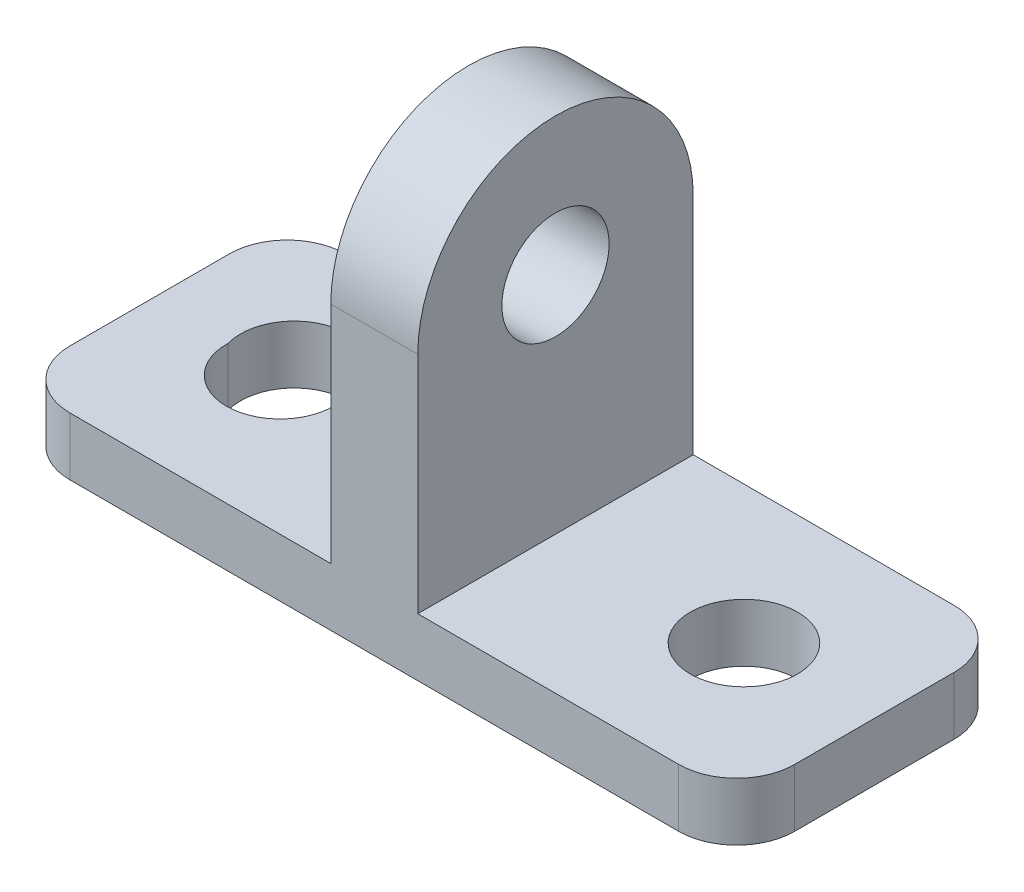
from build123d import *

# Parameters (mm, degrees)
SKETCH1_W           = 25
SKETCH1_H           = 14.5
BOSS_EXTRUDE1_DEPTH = 9.5
CUT_EXTRUDE1_DEPTH  = 28.709429803
SKETCH3_W           = 11
SKETCH3_H           = 12.5
CUT_EXTRUDE2_DEPTH  = 18.293423606
SKETCH4_R           = 1.85
CUT_EXTRUDE3_DEPTH  = 19.406860134
FILLET1_R           = 2
SKETCH5_R           = 1.85
CUT_EXTRUDE4_DEPTH  = 21.06863224
SKETCH11_R          = 1.85
CUT_EXTRUDE10_DEPTH = 104.327776008


with BuildPart() as part:
    # Sketch1 → Boss-Extrude1 (new body)
    with BuildSketch(Plane.XY):
        Rectangle(SKETCH1_W, SKETCH1_H)
    extrude(amount=BOSS_EXTRUDE1_DEPTH)

    # Sketch2 → Cut-Extrude1 (cut, through all)
    with BuildSketch(Plane(origin=(12.5, 0, 0), x_dir=(0, 0, -1), z_dir=(1, 0, 0))):
        with BuildLine():
            Line((-9.5, 2.5), (-9.5, 8.25))
            Line((-9.5, 8.25), (0, 8.25))
            Line((0, 8.25), (0, 2.5))
            ThreePointArc((0, 2.5), (-4.75, 7.25), (-9.5, 2.5))
        make_face()
    extrude(amount=-CUT_EXTRUDE1_DEPTH, mode=Mode.SUBTRACT)

    # Sketch3 → Cut-Extrude2 (cut, through all)
    with BuildSketch(Plane.XY.offset(9.5)):
        with Locations((7, 1)):
            Rectangle(SKETCH3_W, SKETCH3_H)
        with Locations((-7, 1)):
            Rectangle(SKETCH3_W, SKETCH3_H)
    extrude(amount=-CUT_EXTRUDE2_DEPTH, mode=Mode.SUBTRACT)

    # Sketch4 → Cut-Extrude3 (cut, through all)
    with BuildSketch(Plane(origin=(1.5, 0, 0), x_dir=(0, 0, -1), z_dir=(1, 0, 0))):
        with Locations(Location((-4.75, 2.5, 0), (0, 0, 90))):
            Circle(SKETCH4_R)
    extrude(amount=-CUT_EXTRUDE3_DEPTH, mode=Mode.SUBTRACT)

    # Fillet1
    fillet1_edges = [part.edges().sort_by_distance(p)[0] for p in [
        (12.5, -6.25, 9.5),
        (12.5, -6.25, 0),
        (-12.5, -6.25, 9.5),
        (-12.5, -6.25, 0),
    ]]
    fillet(fillet1_edges, radius=FILLET1_R)

    # Sketch5 → Cut-Extrude4 (cut, through all)
    with BuildSketch(Plane(origin=(0, -5.25, 0), x_dir=(1, 0, 0), z_dir=(0, 1, 0))):
        with Locations(Location((-8, -4.75, 0), (0, 0, 180))):
            Circle(SKETCH5_R)
        with Locations(Location((8, -4.75, 0), (0, 0, 180))):
            Circle(SKETCH5_R)
    extrude(amount=-CUT_EXTRUDE4_DEPTH, mode=Mode.SUBTRACT)

    # Sketch11 → Cut-Extrude10 (cut, through all)
    with BuildSketch(Plane(origin=(-55.7, -5.25, -67.11030802), x_dir=(-1, 0, 0), z_dir=(0, 1, 0))):
        with Locations((-47.633605072, 71.30556155)):
            Circle(SKETCH11_R)
    extrude(amount=-CUT_EXTRUDE10_DEPTH, mode=Mode.SUBTRACT)


solid = part.part
